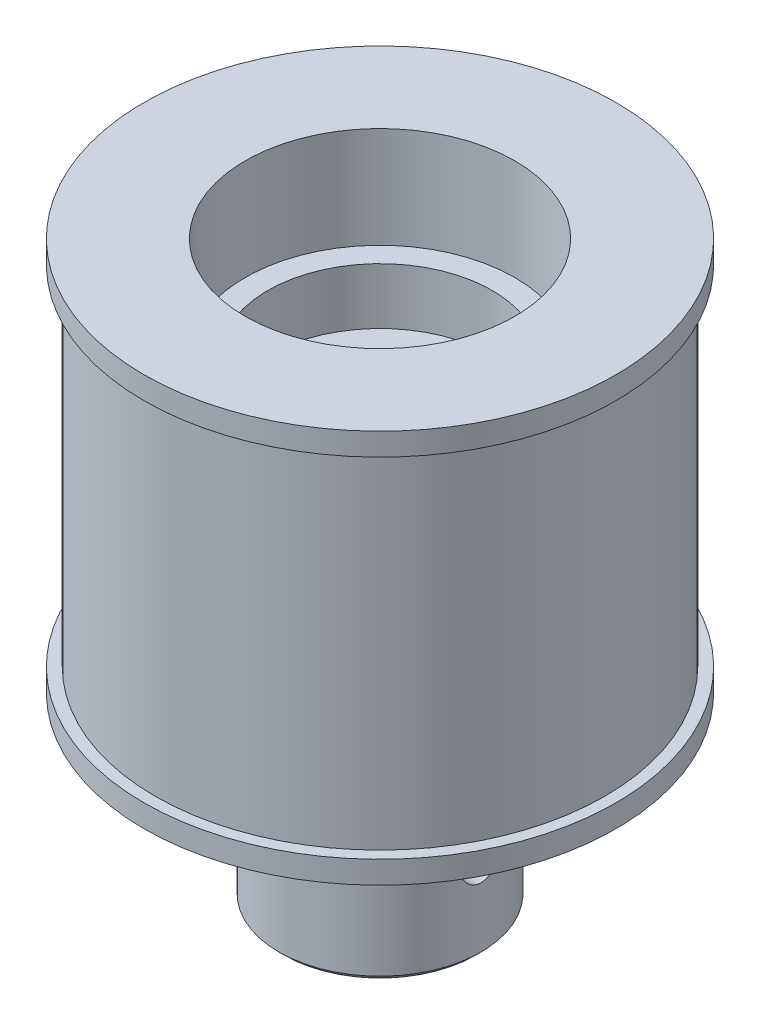
from build123d import *

# Parameters (mm, degrees)
SKETCH_1_R            = 21
EXTRUDE_1_DEPTH       = 17.5
SKETCH_2_W            = 1
SKETCH_2_H            = 31
SKETCH_3_R            = 12
CUT_EXTRUDE_1_DEPTH   = 9
SKETCH_4_R            = 9
EXTRUDE_2_DEPTH       = 16
HOLE_WIZARD_M4_2_D    = 3.3
HOLE_WIZARD_8_0_8_1_D = 8
CHAMFER_2_SIZE        = 0.5
SKETCH_15_R           = 10
CUT_EXTRUDE_3_DEPTH   = 5
SCALE1_SCALE          = 2


with BuildPart() as part:
    # 草图1 → 凸台-拉伸1 (new, symmetric)
    with BuildSketch(Plane(origin=(0, 0, 0), x_dir=(1, 0, 0), z_dir=(0, 1, 0))):
        with Locations(Location((0, 0, 0), (0, 0, 270))):
            Circle(SKETCH_1_R)
    extrude(amount=EXTRUDE_1_DEPTH, both=True)

    # 草图2 → 切除-旋转1 (revolve, cut)
    with BuildSketch(Plane.XY, mode=Mode.PRIVATE) as cut_revolve_1_sk:
        with Locations((20.5, 0)):
            Rectangle(SKETCH_2_W, SKETCH_2_H)
    revolve(cut_revolve_1_sk.sketch.rotate(Axis((0, 17.5, 0), (0, -1, 0)), 90), axis=Axis((0, 17.5, 0), (0, -1, 0)), mode=Mode.SUBTRACT)

    # 草图3 → 切除-拉伸1 (cut)
    with BuildSketch(Plane(origin=(0, 17.5, 0), x_dir=(1, 0, 0), z_dir=(0, 1, 0))):
        with Locations(Location((0, 0, 0), (0, 0, 270))):
            Circle(SKETCH_3_R)
    extrude(amount=-CUT_EXTRUDE_1_DEPTH, mode=Mode.SUBTRACT)

    # 草图4 → 凸台-拉伸2 (add)
    with BuildSketch(Plane.XZ.offset(17.5)):
        with Locations(Location((0, 0, 0), (0, 0, 90))):
            Circle(SKETCH_4_R)
    extrude(amount=EXTRUDE_2_DEPTH)

    # M4 螺纹孔2 (through all)
    with Locations(Plane(origin=(-43.616669336, 0, 0), x_dir=(0, 0, -1), z_dir=(-1, 0, 0))):
        with Locations((0, 26)):
            Hole(HOLE_WIZARD_M4_2_D / 2)

    # Ø8.0 (8) 直径孔1 (through all)
    with Locations(Plane(origin=(0, -33.5, 0), x_dir=(-1, 0, 0), z_dir=(0, -1, 0))):
        with Locations((0, 0)):
            Hole(HOLE_WIZARD_8_0_8_1_D / 2)

    # 倒角2
    chamfer_2_edges = [part.edges().sort_by_distance(p)[0] for p in [
        (0, -33.5, -9),
        (-4, -33.5, 0),
    ]]
    chamfer(chamfer_2_edges, length=CHAMFER_2_SIZE)

    # 草图15 → 切除-拉伸3 (cut)
    with BuildSketch(Plane(origin=(0, 8.5, 0), x_dir=(1, 0, 0), z_dir=(0, 1, 0))):
        with Locations(Location((0, 0, 0), (0, 0, 270))):
            Circle(SKETCH_15_R)
    extrude(amount=-CUT_EXTRUDE_3_DEPTH, mode=Mode.SUBTRACT)


with BuildPart() as part_1:
    # Scale1: scaled about (-1.22e-07, -3.311996838, 3.643e-06)
    add(part.part.scale(SCALE1_SCALE).moved(Location((1.22e-07, 3.311996838, -3.643e-06))))


solid = part_1.part
